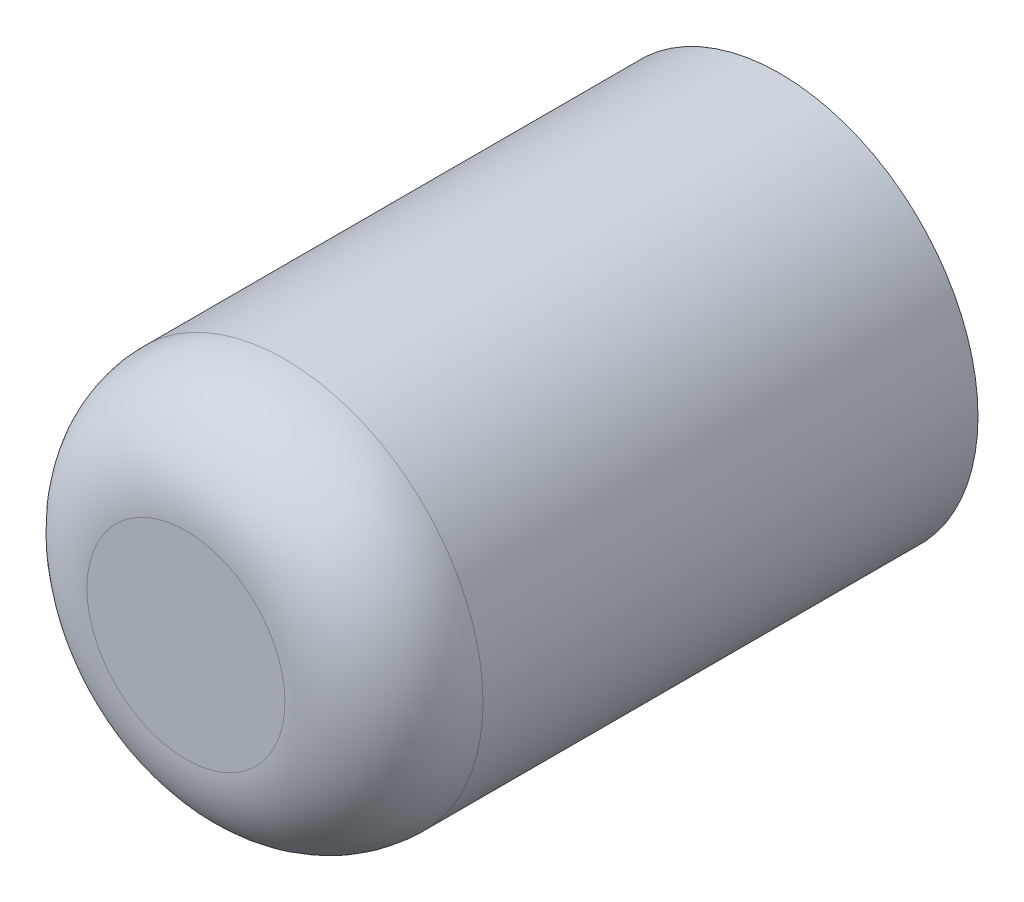
from build123d import *

# Parameters (mm, degrees)
SKETCH_1_R          = 2
EXTRUDE_1_DEPTH     = 6
FILLET_1_R          = 1
CUT_EXTRUDE_1_DEPTH = 1.5


with BuildPart() as part:
    # 草图1 → 凸台-拉伸1 (new body)
    with BuildSketch(Plane.XY):
        Circle(SKETCH_1_R)
    extrude(amount=EXTRUDE_1_DEPTH)

    # 圆角1
    fillet_1_edges = [part.edges().sort_by_distance(p)[0] for p in [
        (-2, 0, 6),
    ]]
    fillet(fillet_1_edges, radius=FILLET_1_R)

    # 草图2 → 切除-拉伸1 (cut)
    with BuildSketch(Plane(origin=(0, 0, 0), x_dir=(-1, 0, 0), z_dir=(0, 0, -1))):
        Polygon((1.154700538, 0), (0.577350269, 1), (-0.577350269, 1), (-1.154700538, 0), (-0.577350269, -1), (0.577350269, -1), align=None)
    extrude(amount=-CUT_EXTRUDE_1_DEPTH, mode=Mode.SUBTRACT)


solid = part.part
